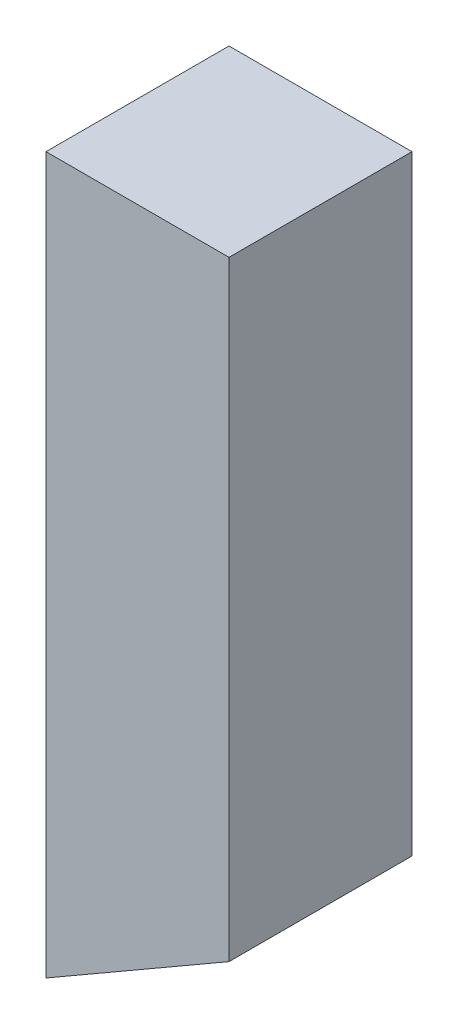
from build123d import *

# Parameters (mm, degrees)
ESQUISSE1_W        = 60
ESQUISSE1_H        = 200
BOSS_EXTRU_1_DEPTH = 60
BOSS_EXTRU_2_DEPTH = 60


with BuildPart() as part:
    # Esquisse1 → Boss.-Extru.1 (new body)
    with BuildSketch(Plane.XY):
        with Locations((30, 100)):
            Rectangle(ESQUISSE1_W, ESQUISSE1_H)
    extrude(amount=BOSS_EXTRU_1_DEPTH)

    # Esquisse2 → Boss.-Extru.2 (add)
    with BuildSketch(Plane.XY.offset(60)):
        Polygon((60, 0), (0, 0), (0, -34.641016151), align=None)
    extrude(amount=-BOSS_EXTRU_2_DEPTH)


solid = part.part
